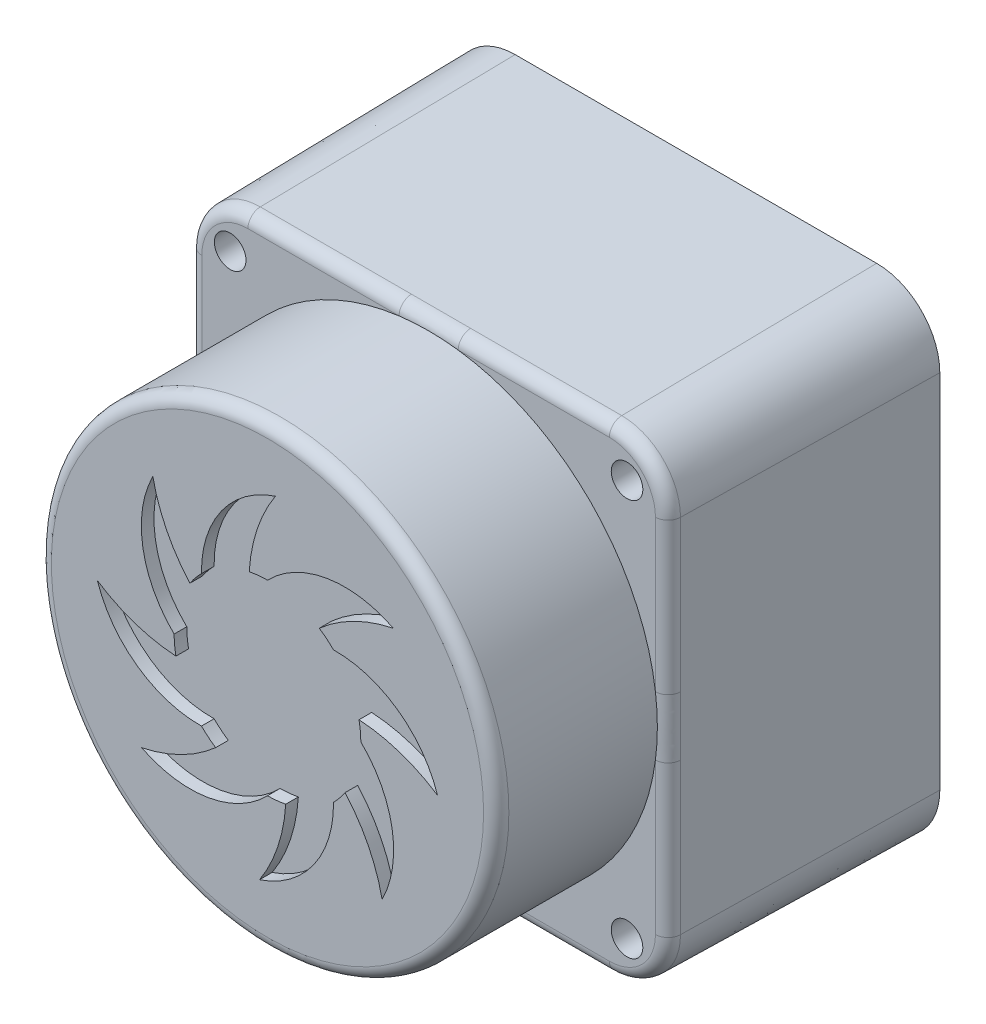
from build123d import *

# Parameters (mm, degrees)
BOSS_EXTRUDE1_DEPTH = 21.15
BOSS_EXTRUDE1_TAPER = 1
SKETCH2_R           = 18.1
BOSS_EXTRUDE2_DEPTH = 12.75
SKETCH3_R           = 1.25
CUT_EXTRUDE1_DEPTH  = 35.529733564
FILLET1_R           = 1
CUT_EXTRUDE2_DEPTH  = 1
CIRPATTERN1_COUNT   = 8


with BuildPart() as part:
    # Sketch1 → Boss-Extrude1 (new body)
    with BuildSketch(Plane.XY):
        with BuildLine():
            ThreePointArc((-14.3, 19.3), (-17.835533906, 17.835533906), (-19.3, 14.3))
            Line((-19.3, 14.3), (-19.3, -14.3))
            ThreePointArc((-19.3, -14.3), (-17.835533906, -17.835533906), (-14.3, -19.3))
            Line((-14.3, -19.3), (14.3, -19.3))
            ThreePointArc((14.3, -19.3), (17.835533906, -17.835533906), (19.3, -14.3))
            Line((19.3, -14.3), (19.3, 14.3))
            ThreePointArc((19.3, 14.3), (17.835533906, 17.835533906), (14.3, 19.3))
            Line((14.3, 19.3), (-14.3, 19.3))
        make_face()
    extrude(amount=BOSS_EXTRUDE1_DEPTH, taper=BOSS_EXTRUDE1_TAPER)

    # Sketch2 → Boss-Extrude2 (add)
    with BuildSketch(Plane.XY.offset(21.15)):
        Circle(SKETCH2_R)
    extrude(amount=BOSS_EXTRUDE2_DEPTH)

    # Sketch3 → Cut-Extrude1 (cut, through all)
    with BuildSketch(Plane.XY.offset(21.15)):
        with Locations((-15.7, 15.7)):
            Circle(SKETCH3_R)
        with Locations(Location((15.7, 15.7, 0), (0, 0, 180))):
            Circle(SKETCH3_R)
        with Locations((15.7, -15.7)):
            Circle(SKETCH3_R)
        with Locations(Location((-15.7, -15.7, 0), (0, 0, 180))):
            Circle(SKETCH3_R)
    extrude(amount=-CUT_EXTRUDE1_DEPTH, mode=Mode.SUBTRACT)

    # Fillet1
    fillet1_edges = [part.edges().sort_by_distance(p)[0] for p in [
        (17.574488026, -17.574488026, 21.15),
        (18.930825377, 0, 21.15),
        (17.574488026, 17.574488026, 21.15),
        (0, 18.930825377, 21.15),
        (-17.574488026, 17.574488026, 21.15),
        (-18.1, 0, 33.9),
        (-18.930825377, 0, 21.15),
        (-17.574488026, -17.574488026, 21.15),
        (0, -18.930825377, 21.15),
    ]]
    fillet(fillet1_edges, radius=FILLET1_R)

    # Sketch4 → Cut-Extrude2 (cut)
    with BuildSketch(Plane.XY.offset(33.9)):
        with BuildLine():
            ThreePointArc((0, 7.385996988), (-2.142431463, -7.068446712), (4.100641433, 6.143101118))
            ThreePointArc((4.100641433, 6.143101118), (6.838415629, 7.989504917), (9.958635041, 9.070636436))
            ThreePointArc((9.958635041, 9.070636436), (4.702829161, 9.862759424), (0, 7.385996988))
        make_face()
    cut_extrude2 = extrude(amount=-CUT_EXTRUDE2_DEPTH, mode=Mode.SUBTRACT)

    # CirPattern1: Cut-Extrude2 ×8 about axis
    cirpattern1_axis = Axis((0, 0, 0), (0, 0, 1))
    for i in range(1, CIRPATTERN1_COUNT):
        add(cut_extrude2.rotate(cirpattern1_axis, i * 360 / CIRPATTERN1_COUNT), mode=Mode.SUBTRACT)


solid = part.part
